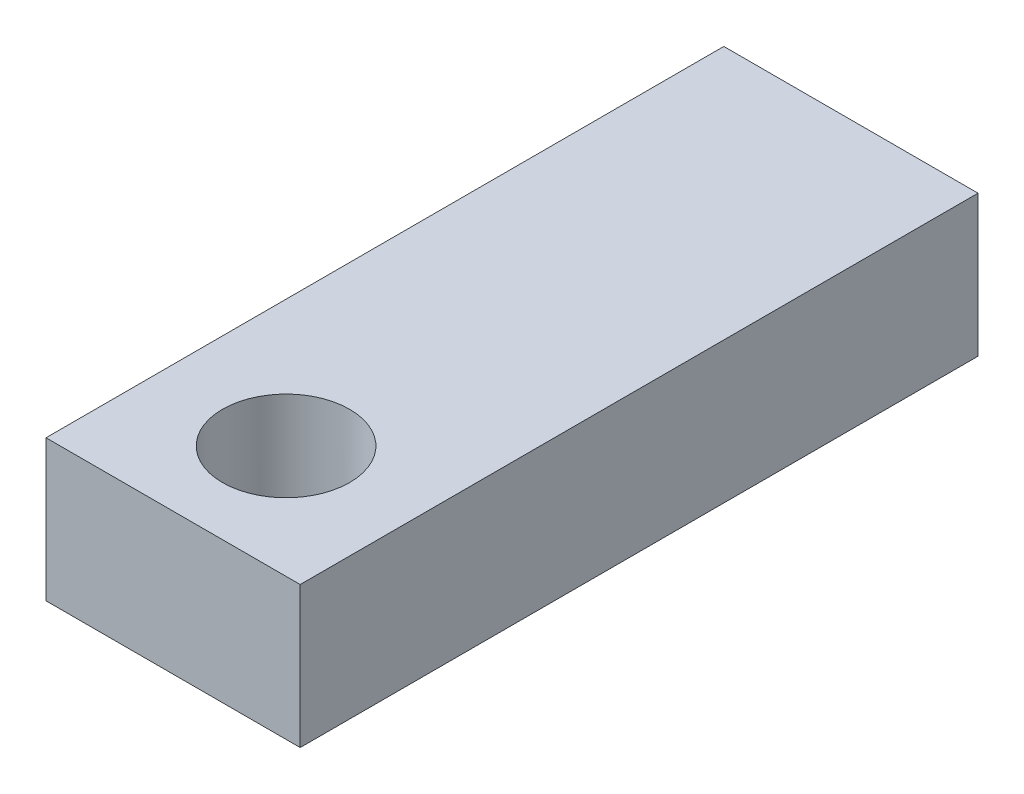
from build123d import *

# Parameters (mm, degrees)
CROQUIS1_W              = 9
CROQUIS1_H              = 5
SALIENTE_EXTRUIR1_DEPTH = 24
CROQUIS2_W              = 7.5
CROQUIS2_H              = 3.5
CORTAR_EXTRUIR1_DEPTH   = 9
CROQUIS3_R              = 2.25
CORTAR_EXTRUIR2_DEPTH   = 9


with BuildPart() as part:
    # Croquis1 → Saliente-Extruir1 (new body)
    with BuildSketch(Plane.XY):
        Rectangle(CROQUIS1_W, CROQUIS1_H)
    extrude(amount=SALIENTE_EXTRUIR1_DEPTH)

    # Croquis2 → Cortar-Extruir1 (cut)
    with BuildSketch(Plane(origin=(0, 0, 0), x_dir=(-1, 0, 0), z_dir=(0, 0, -1))):
        Rectangle(CROQUIS2_W, CROQUIS2_H)
    extrude(amount=-CORTAR_EXTRUIR1_DEPTH, mode=Mode.SUBTRACT)

    # Croquis3 → Cortar-Extruir2 (cut)
    with BuildSketch(Plane(origin=(0, 2.5, 0), x_dir=(1, 0, 0), z_dir=(0, 1, 0))):
        with Locations(Location((0, -20, 0), (0, 0, 180))):
            Circle(CROQUIS3_R)
    extrude(amount=-CORTAR_EXTRUIR2_DEPTH, mode=Mode.SUBTRACT)


solid = part.part
